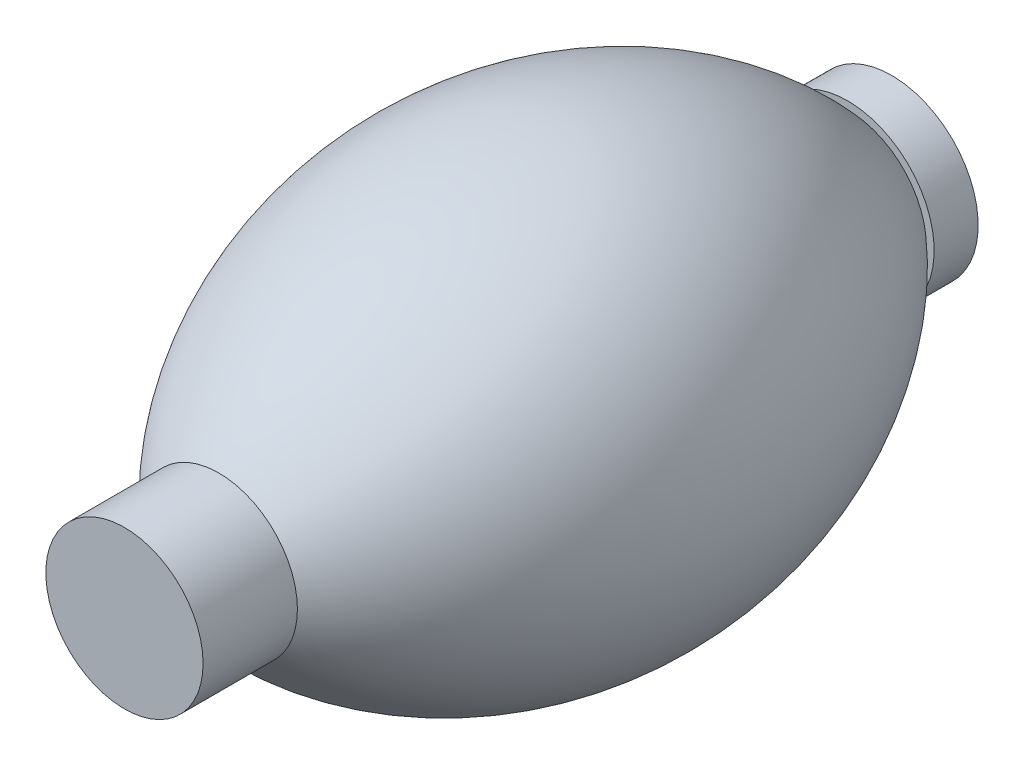
from build123d import *

# Parameters (mm, degrees)
SKETCH2_R           = 25
BOSS_EXTRUDE1_DEPTH = 30
SKETCH3_R           = 27.5
BOSS_EXTRUDE2_DEPTH = 14


with BuildPart() as part:
    # Sketch1 → Revolve1 (revolve)
    with BuildSketch(Plane(origin=(0, 0, 0), x_dir=(0, 0, -1), z_dir=(1, 0, 0)), mode=Mode.PRIVATE) as revolve1_sk:
        with BuildLine():
            Line((-100, 0), (-100, 25))
            ThreePointArc((-100, 25), (0, 70.020961978), (100, 25))
            Line((100, 25), (100, 0))
            Line((100, 0), (-100, 0))
        make_face()
    revolve(revolve1_sk.sketch.rotate(Axis((0, 0, 74.117927805), (0, 0, -1)), 90), axis=Axis((0, 0, 74.117927805), (0, 0, -1)))

    # Sketch2 → Boss-Extrude1 (add)
    with BuildSketch(Plane.XY.offset(100)):
        Circle(SKETCH2_R)
    extrude(amount=BOSS_EXTRUDE1_DEPTH)

    # Sketch3 → Boss-Extrude2 (add)
    with BuildSketch(Plane(origin=(0, 0, -100), x_dir=(-1, 0, 0), z_dir=(0, 0, -1))):
        Circle(SKETCH3_R)
    extrude(amount=BOSS_EXTRUDE2_DEPTH)


solid = part.part
